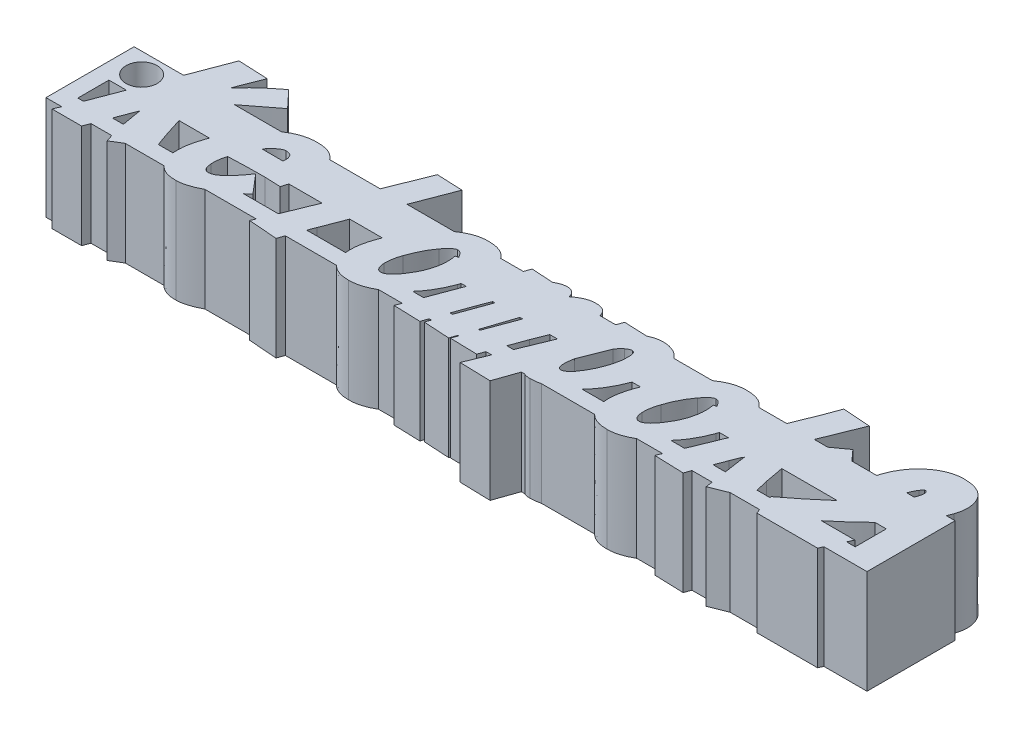
from build123d import *

# Parameters (mm, degrees)
BOSS_EXTRUDE2_DEPTH   = 10
BOSS_EXTRUDE2_2_DEPTH = 10
BOSS_EXTRUDE2_3_DEPTH = 10
BOSS_EXTRUDE2_4_DEPTH = 10
BOSS_EXTRUDE2_5_DEPTH = 10
BOSS_EXTRUDE2_6_DEPTH = 10
BOSS_EXTRUDE2_7_DEPTH = 10
BOSS_EXTRUDE2_8_DEPTH = 10
BOSS_EXTRUDE2_9_DEPTH = 10
SKETCH6_W             = 79.208015904
SKETCH6_H             = 8.5
BOSS_EXTRUDE10_DEPTH  = 10
SKETCH9_R             = 1.5
CUT_EXTRUDE3_DEPTH    = 25


with BuildPart() as part:
    # Sketch4 → Boss-Extrude2 (new body)
    with BuildSketch(Plane(origin=(0, 0, 0), x_dir=(1, 0, 0), z_dir=(0, 1, 0))):
        with BuildLine():
            Line((14.050540425, 0.250084138), (11.135237966, -1.530703367))
            add(Edge.make_bspline(
                [(11.135237966, -1.530703367), (11.087695538, -1.40216121), (10.988992195, -1.135293458), (10.858899008, -0.712824719), (10.733827761, -0.25563048), (10.613807543, 0.236634377), (10.500845834, 0.765237521), (10.396223522, 1.32872214), (10.293179083, 1.926754701), (10.234010137, 2.338125899), (10.203567682, 2.549776612)],
                knots=[0, 0, 0, 0, 0.784209887, 1.628106556, 2.528649659, 3.496628651, 4.527386822, 5.621651958, 6.776338601, 8, 8, 8, 8], degree=3))
            Line((10.203567682, 2.549776612), (8.658646071, -1.530703367))
            Line((8.658646071, -1.530703367), (5.809386063, -1.530703367))
            add(Edge.make_bspline(
                [(5.809386063, -1.530703367), (5.888539112, -1.346164415), (6.053448141, -0.961692313), (6.299001696, -0.359638384), (6.557951226, 0.288309455), (6.728384495, 0.737270317), (6.816533433, 0.969475117)],
                knots=[0, 0, 0, 0, 0.893857492, 1.862280367, 2.894360729, 4, 4, 4, 4], degree=3))
            Line((6.816533433, 0.969475117), (10.81210169, 11.507963294))
            Line((10.81210169, 11.507963294), (13.654285722, 11.38059571))
            Line((13.654285722, 11.38059571), (12.651855669, 8.80494014))
            add(Edge.make_bspline(
                [(12.651855669, 8.80494014), (12.746245393, 8.913323974), (12.939268925, 9.134964948), (13.249556069, 9.461921617), (13.581373248, 9.795587395), (13.9411507, 10.128576132), (14.321060315, 10.469982939), (14.727391349, 10.813868914), (15.157706898, 11.162074621), (15.455811495, 11.391440349), (15.60725533, 11.507963294)],
                knots=[0, 0, 0, 0, 0.859551829, 1.757752034, 2.695460725, 3.673637262, 4.689399904, 5.750344541, 6.857124468, 8, 8, 8, 8], degree=3))
            Line((15.60725533, 11.507963294), (17.142742305, 9.861619348))
            add(Edge.make_bspline(
                [(17.142742305, 9.861619348), (16.954644827, 9.720352478), (16.572785354, 9.433564516), (15.995086376, 8.992239989), (15.403158907, 8.534520747), (14.797056998, 8.061308324), (14.179853892, 7.569521082), (13.546091457, 7.065234295), (12.900668953, 6.541317143), (12.466173219, 6.18542031), (12.24616633, 6.005211969)],
                knots=[0, 0, 0, 0, 0.905720717, 1.838717028, 2.799025323, 3.78667897, 4.799336057, 5.837515503, 6.905026102, 8, 8, 8, 8], degree=3))
            add(Edge.make_bspline(
                [(12.24616633, 6.005211969), (12.323692162, 5.716586261), (12.475291816, 5.152186544), (12.702643856, 4.32655531), (12.93127978, 3.544355947), (13.159090517, 2.804116898), (13.38038451, 2.104692149), (13.606512099, 1.449340233), (13.823732542, 0.833840494), (13.976451144, 0.440774548), (14.050540425, 0.250084138)],
                knots=[0, 0, 0, 0, 1.188561491, 2.324199641, 3.405703956, 4.429397032, 5.404413241, 6.323022466, 7.186437956, 8, 8, 8, 8], degree=3))
        make_face()
    extrude(amount=BOSS_EXTRUDE2_DEPTH)



with BuildPart() as body_2:
    # Sketch4 → Boss-Extrude2 2 (new body)
    with BuildSketch(Plane(origin=(0, 0, 0), x_dir=(1, 0, 0), z_dir=(0, 1, 0))):
        with BuildLine():
            add(Edge.make_bspline(
                [(22.624265698, 1.035517567), (22.499652301, 0.932039331), (22.256199499, 0.729877549), (21.891645526, 0.440820924), (21.535778389, 0.172404589), (21.190082997, -0.077348305), (20.853907058, -0.30770088), (20.526264385, -0.517011922), (20.208627222, -0.708998472), (19.898841945, -0.878661463), (19.600396232, -1.029998384), (19.310865328, -1.160913158), (19.030519563, -1.271513758), (18.759500044, -1.364784331), (18.496877572, -1.435549508), (18.244101779, -1.487556517), (18.000708181, -1.523067304), (17.841018801, -1.528198618), (17.763069608, -1.530703367)],
                knots=[0, 0, 0, 0, 1.391070573, 2.717685548, 3.995225702, 5.21895646, 6.380134823, 7.494610867, 8.557662761, 9.567011913, 10.527286661, 11.430908901, 12.294832988, 13.114784853, 13.891181043, 14.628789799, 15.330671029, 16, 16, 16, 16], degree=3))
            add(Edge.make_bspline(
                [(17.763069608, -1.530703367), (17.622875549, -1.527002352), (17.352587373, -1.519866953), (16.965148021, -1.455031968), (16.615408616, -1.339132781), (16.304933532, -1.174392099), (16.029771467, -0.96498885), (15.800082319, -0.701190982), (15.60230167, -0.394793736), (15.510625531, -0.163799115), (15.463377134, -0.044748231)],
                knots=[0, 0, 0, 0, 1.14053067, 2.198894579, 3.18440771, 4.126236127, 5.047824347, 5.981552319, 6.959724779, 8, 8, 8, 8], degree=3))
            add(Edge.make_bspline(
                [(15.463377134, -0.044748231), (15.429258258, 0.066244253), (15.359513545, 0.29313153), (15.303718194, 0.654680179), (15.279768863, 1.039166001), (15.295207011, 1.447411835), (15.349425724, 1.879926103), (15.437192889, 2.335976324), (15.560024408, 2.817551267), (15.667326149, 3.141630068), (15.722829618, 3.309264793)],
                knots=[0, 0, 0, 0, 0.812872449, 1.66164781, 2.55596979, 3.50977609, 4.519899369, 5.608110557, 6.762758536, 8, 8, 8, 8], degree=3))
            add(Edge.make_bspline(
                [(15.722829618, 3.309264793), (15.790545955, 3.497279931), (15.924016187, 3.867861474), (16.160551761, 4.401032894), (16.41278506, 4.910515257), (16.696168913, 5.388299853), (16.994470205, 5.844746287), (17.321093864, 6.270231547), (17.666642212, 6.672360196), (17.918415293, 6.916680108), (18.043750023, 7.038304588)],
                knots=[0, 0, 0, 0, 1.080935972, 2.130546102, 3.154073367, 4.155083915, 5.134372394, 6.102621782, 7.055469378, 8, 8, 8, 8], degree=3))
            add(Edge.make_bspline(
                [(18.043750023, 7.038304588), (18.173247332, 7.152923474), (18.426681532, 7.377239682), (18.829745706, 7.67006775), (19.238790464, 7.919305759), (19.655456317, 8.125116155), (20.08184476, 8.279457337), (20.513712125, 8.395585334), (20.954620553, 8.462225636), (21.251315043, 8.472122693), (21.400121705, 8.477086546)],
                knots=[0, 0, 0, 0, 1.109112086, 2.170600574, 3.191491309, 4.179676445, 5.146829528, 6.096350185, 7.045227389, 8, 8, 8, 8], degree=3))
            add(Edge.make_bspline(
                [(21.400121705, 8.477086546), (21.550597253, 8.47301465), (21.838437179, 8.465225648), (22.248052871, 8.394097603), (22.613975274, 8.277391483), (22.935578013, 8.111014918), (23.212422016, 7.895646353), (23.441259174, 7.630196978), (23.630100886, 7.320174687), (23.710380532, 7.087377657), (23.751704675, 6.96754482)],
                knots=[0, 0, 0, 0, 1.193090666, 2.282225473, 3.286311646, 4.229385653, 5.140326509, 6.051075119, 6.996786178, 8, 8, 8, 8], degree=3))
            add(Edge.make_bspline(
                [(23.751704675, 6.96754482), (23.781301198, 6.847781062), (23.843179105, 6.59738913), (23.881358717, 6.193230931), (23.883028923, 5.75208076), (23.842109625, 5.27220055), (23.767011645, 4.754465879), (23.648111696, 4.198622529), (23.495698883, 3.60312774), (23.367686268, 3.197037924), (23.301200816, 2.986128517)],
                knots=[0, 0, 0, 0, 0.728497765, 1.523081497, 2.39227737, 3.3341221, 4.367451498, 5.483232794, 6.692875668, 8, 8, 8, 8], degree=3))
            add(Edge.make_bspline(
                [(23.301200816, 2.986128517), (23.041853901, 3.004398577), (22.536909495, 3.039970099), (22.030764535, 3.046591673), (21.784583113, 3.049812308)],
                knots=[0, 0, 0, 0, 1.027229582, 2, 2, 2, 2], degree=3))
            add(Edge.make_bspline(
                [(21.784583113, 3.049812308), (21.499180646, 3.048847572), (20.923624368, 3.046902038), (20.050838442, 3.032707095), (19.161588252, 3.006566101), (18.562633093, 2.981999837), (18.260746646, 2.969617904)],
                knots=[0, 0, 0, 0, 0.971572485, 1.95931958, 2.971452619, 4, 4, 4, 4], degree=3))
            add(Edge.make_bspline(
                [(18.260746646, 2.969617904), (18.223014936, 2.846791928), (18.149533739, 2.607592592), (18.081438463, 2.248849546), (18.05058013, 1.903151397), (18.060240294, 1.6786683), (18.064977953, 1.568574489)],
                knots=[0, 0, 0, 0, 1.082333424, 2.107806866, 3.072006958, 4, 4, 4, 4], degree=3))
            add(Edge.make_bspline(
                [(18.064977953, 1.568574489), (18.071762362, 1.500040354), (18.08447221, 1.371649143), (18.118453876, 1.192273567), (18.169281136, 1.040063801), (18.235974466, 0.915187596), (18.313604218, 0.814654261), (18.409211048, 0.74256848), (18.521064611, 0.701777581), (18.600075777, 0.696309166), (18.640490736, 0.69351202)],
                knots=[0, 0, 0, 0, 1.422743012, 2.66535353, 3.764839852, 4.724340628, 5.579401389, 6.368983025, 7.165719376, 8, 8, 8, 8], degree=3))
            add(Edge.make_bspline(
                [(18.640490736, 0.69351202), (18.687073912, 0.695991771), (18.782128563, 0.701051791), (18.926135097, 0.737113171), (19.075282745, 0.791246966), (19.228943441, 0.869689703), (19.383992003, 0.974021947), (19.548104656, 1.093619063), (19.71559583, 1.238436519), (19.824434859, 1.346935211), (19.881145343, 1.403468363)],
                knots=[0, 0, 0, 0, 0.763034404, 1.556999236, 2.421266155, 3.360662658, 4.375763195, 5.481460041, 6.68771688, 8, 8, 8, 8], degree=3))
            add(Edge.make_bspline(
                [(19.881145343, 1.403468363), (19.989552924, 1.517727374), (20.206016113, 1.745874423), (20.503860448, 2.111366522), (20.786478005, 2.488081063), (20.958093808, 2.750861576), (21.043964204, 2.882347523)],
                knots=[0, 0, 0, 0, 1.002604599, 2.001953979, 3.000249405, 4, 4, 4, 4], degree=3))
            Line((21.043964204, 2.882347523), (22.624265698, 1.035517567))
        make_face()
        with BuildLine():
            add(Edge.make_bspline(
                [(21.289264734, 5.257517083), (21.300844399, 5.320187262), (21.323447112, 5.442515158), (21.320604207, 5.627955106), (21.285484386, 5.808007732), (21.237861077, 5.920196833), (21.213787648, 5.976908062)],
                knots=[0, 0, 0, 0, 1.035215894, 2.020670521, 2.999455327, 4, 4, 4, 4], degree=3))
            add(Edge.make_bspline(
                [(21.213787648, 5.976908062), (21.185253505, 6.022118135), (21.127631409, 6.113415748), (20.981742274, 6.203505619), (20.804210227, 6.258145621), (20.673370694, 6.263915312), (20.602894981, 6.267023113)],
                knots=[0, 0, 0, 0, 0.891253418, 1.799804852, 2.814881707, 4, 4, 4, 4], degree=3))
            add(Edge.make_bspline(
                [(20.602894981, 6.267023113), (20.564127462, 6.264548969), (20.482762621, 6.259356265), (20.358928538, 6.220623305), (20.227745368, 6.161225665), (20.092292548, 6.073930287), (19.94658989, 5.967787448), (19.797730909, 5.8341161), (19.63771324, 5.680845875), (19.534432867, 5.565680003), (19.480173322, 5.505176273)],
                knots=[0, 0, 0, 0, 0.668342593, 1.402710055, 2.222495443, 3.148784853, 4.177361244, 5.331300504, 6.597967686, 8, 8, 8, 8], degree=3))
            add(Edge.make_bspline(
                [(19.480173322, 5.505176273), (19.440389959, 5.456166607), (19.372495159, 5.372526079), (19.301858162, 5.291192689), (19.272611334, 5.257517083)],
                knots=[0, 0, 0, 0, 1.171911923, 2, 2, 2, 2], degree=3))
            Line((19.272611334, 5.257517083), (21.289264734, 5.257517083))
        make_face(mode=Mode.SUBTRACT)
    extrude(amount=BOSS_EXTRUDE2_2_DEPTH)


with BuildPart() as body_3:
    # Sketch4 → Boss-Extrude2 3 (new body)
    with BuildSketch(Plane(origin=(0, 0, 0), x_dir=(1, 0, 0), z_dir=(0, 1, 0))):
        with BuildLine():
            Line((32.365527151, 11.463148774), (28.499685136, 1.349219207))
            add(Edge.make_bspline(
                [(28.499685136, 1.349219207), (28.397424196, 1.088513869), (28.198588365, 0.581599276), (27.923034565, -0.161469756), (27.663110595, -0.858847662), (27.505156532, -1.311865117), (27.428853974, -1.530703367)],
                knots=[0, 0, 0, 0, 1.093622992, 2.126436907, 3.094941564, 4, 4, 4, 4], degree=3))
            Line((27.428853974, -1.530703367), (24.655071052, -1.327858698))
            add(Edge.make_bspline(
                [(24.655071052, -1.327858698), (24.713906682, -1.190214812), (24.834621177, -0.907807496), (25.022144034, -0.476101515), (25.209281933, -0.020800742), (25.408061298, 0.450789028), (25.610730573, 0.944473343), (25.824011649, 1.455717472), (26.036734947, 1.990513753), (26.184002305, 2.351757248), (26.258959136, 2.535624658)],
                knots=[0, 0, 0, 0, 0.858797452, 1.762015657, 2.700225699, 3.682848602, 4.698090038, 5.761909301, 6.860846093, 8, 8, 8, 8], degree=3))
            Line((26.258959136, 2.535624658), (29.893652574, 11.569288426))
            Line((29.893652574, 11.569288426), (32.365527151, 11.463148774))
        make_face()
    extrude(amount=BOSS_EXTRUDE2_3_DEPTH)


with BuildPart() as body_4:
    # Sketch4 → Boss-Extrude2 4 (new body)
    with BuildSketch(Plane(origin=(0, 0, 0), x_dir=(1, 0, 0), z_dir=(0, 1, 0))):
        with BuildLine():
            add(Edge.make_bspline(
                [(40.038244707, 3.370589925), (39.982126243, 3.215663655), (39.870497367, 2.907489765), (39.667054808, 2.461518646), (39.444603074, 2.029746196), (39.195062904, 1.614974524), (38.922486456, 1.216606363), (38.622775797, 0.836269086), (38.303396234, 0.468241319), (38.070373363, 0.239902733), (37.953190197, 0.125075214)],
                knots=[0, 0, 0, 0, 1.01501599, 2.019034128, 3.017989721, 4.006742464, 4.999841863, 5.990337927, 6.989375757, 8, 8, 8, 8], degree=3))
            add(Edge.make_bspline(
                [(37.953190197, 0.125075214), (37.808089027, -0.006918661), (37.526834487, -0.262766882), (37.08434304, -0.599165239), (36.64487223, -0.886294613), (36.202511102, -1.119592381), (35.760783248, -1.303263461), (35.317298468, -1.433588666), (34.873455506, -1.51550291), (34.576714743, -1.52565958), (34.42935373, -1.530703367)],
                knots=[0, 0, 0, 0, 1.180019893, 2.287272735, 3.341173446, 4.335951553, 5.292850594, 6.21515141, 7.1136469, 8, 8, 8, 8], degree=3))
            add(Edge.make_bspline(
                [(34.42935373, -1.530703367), (34.283632448, -1.526458156), (34.003683133, -1.518302559), (33.604187855, -1.448770425), (33.247702342, -1.326899701), (32.930070645, -1.162200694), (32.657740597, -0.94359491), (32.427473919, -0.678434768), (32.237537364, -0.366315825), (32.153880802, -0.132274302), (32.110791985, -0.011727005)],
                knots=[0, 0, 0, 0, 1.166914392, 2.241792542, 3.233713519, 4.174778755, 5.093510918, 6.013084697, 6.976603536, 8, 8, 8, 8], degree=3))
            add(Edge.make_bspline(
                [(32.110791985, -0.011727005), (32.078451484, 0.096972006), (32.012682975, 0.318025226), (31.958832273, 0.667357059), (31.934475738, 1.034421857), (31.948326433, 1.420348375), (31.993402089, 1.824017588), (32.073361825, 2.24599362), (32.18300941, 2.687794243), (32.281696802, 2.984383796), (32.332505926, 3.137082689)],
                knots=[0, 0, 0, 0, 0.84642706, 1.721316727, 2.633657811, 3.591547291, 4.602158471, 5.665521778, 6.798095765, 8, 8, 8, 8], degree=3))
            add(Edge.make_bspline(
                [(32.332505926, 3.137082689), (32.397928126, 3.321133602), (32.526714985, 3.683446984), (32.754524359, 4.203651427), (32.990187786, 4.702069236), (33.251574131, 5.17040153), (33.525360387, 5.6164975), (33.825305408, 6.029759486), (34.133987986, 6.423591766), (34.361360495, 6.662620121), (34.47416825, 6.781210763)],
                knots=[0, 0, 0, 0, 1.099825324, 2.1650609, 3.196961452, 4.203854639, 5.18442365, 6.142936629, 7.078643458, 8, 8, 8, 8], degree=3))
            add(Edge.make_bspline(
                [(34.47416825, 6.781210763), (34.611291047, 6.916292194), (34.877408121, 7.178447546), (35.299279831, 7.524500711), (35.724857487, 7.816328052), (36.152710069, 8.055661216), (36.582127298, 8.246043679), (37.017031888, 8.377759708), (37.454571853, 8.46245127), (37.748400052, 8.47223232), (37.894223724, 8.477086546)],
                knots=[0, 0, 0, 0, 1.177608953, 2.285410271, 3.334477404, 4.33187011, 5.282184666, 6.203085272, 7.108211176, 8, 8, 8, 8], degree=3))
            add(Edge.make_bspline(
                [(37.894223724, 8.477086546), (37.996535669, 8.475711792), (38.194579151, 8.473050703), (38.480432938, 8.440298019), (38.746169665, 8.395461766), (38.99063593, 8.327129769), (39.213573487, 8.237313144), (39.415413024, 8.128371983), (39.597545954, 8.001458137), (39.701445156, 7.899917994), (39.752846974, 7.849683266)],
                knots=[0, 0, 0, 0, 1.21682243, 2.355382367, 3.419801373, 4.420909787, 5.369491889, 6.273713858, 7.145958333, 8, 8, 8, 8], degree=3))
            add(Edge.make_bspline(
                [(39.752846974, 7.849683266), (39.803573866, 7.793249739), (39.906710103, 7.67851096), (40.041536536, 7.485161977), (40.171310669, 7.277197358), (40.284559976, 7.047600417), (40.392015141, 6.801928028), (40.485745627, 6.53690764), (40.5682328, 6.253170737), (40.613909567, 6.056554366), (40.637344079, 5.955680132)],
                knots=[0, 0, 0, 0, 0.860065863, 1.74865745, 2.669563957, 3.638872161, 4.649604968, 5.710379448, 6.825307782, 8, 8, 8, 8], degree=3))
            Line((40.637344079, 5.955680132), (40.342511711, 5.825953889))
            add(Edge.make_bspline(
                [(40.342511711, 5.825953889), (40.349195965, 5.601796347), (40.36218468, 5.16621765), (40.309540513, 4.530855747), (40.211187776, 3.932053029), (40.095082579, 3.555115204), (40.038244707, 3.370589925)],
                knots=[0, 0, 0, 0, 1.080653131, 2.099904727, 3.069831712, 4, 4, 4, 4], degree=3))
        make_face()
        with BuildLine():
            add(Edge.make_bspline(
                [(37.380036073, 3.365872607), (37.43515134, 3.552677203), (37.54404211, 3.921745477), (37.622316208, 4.488916539), (37.631314455, 5.054186162), (37.575468783, 5.423834599), (37.547500858, 5.608957266)],
                knots=[0, 0, 0, 0, 1.027056828, 2.029147561, 3.012982546, 4, 4, 4, 4], degree=3))
            Line((37.547500858, 5.608957266), (37.844691886, 5.698586306))
            add(Edge.make_bspline(
                [(37.844691886, 5.698586306), (37.811355245, 5.730988916), (37.739855434, 5.800485436), (37.694408512, 5.889369049), (37.670151124, 5.93681086)],
                knots=[0, 0, 0, 0, 0.932495901, 2, 2, 2, 2], degree=3))
            add(Edge.make_bspline(
                [(37.670151124, 5.93681086), (37.636222369, 5.986680808), (37.57170279, 6.081514469), (37.443507205, 6.188509149), (37.29858764, 6.254839736), (37.195943881, 6.262938222), (37.144170178, 6.267023113)],
                knots=[0, 0, 0, 0, 1.109746528, 2.110315559, 3.046839665, 4, 4, 4, 4], degree=3))
            add(Edge.make_bspline(
                [(37.144170178, 6.267023113), (37.113143748, 6.264693739), (37.045630926, 6.259625073), (36.944419892, 6.214460539), (36.835325213, 6.149523877), (36.716055858, 6.061728861), (36.59308131, 5.94384326), (36.457717278, 5.805185388), (36.31663337, 5.638576822), (36.222256313, 5.517331994), (36.172402692, 5.453285776)],
                knots=[0, 0, 0, 0, 0.571144536, 1.242797803, 2.017584967, 2.92111095, 3.969590932, 5.161241196, 6.500457551, 8, 8, 8, 8], degree=3))
            add(Edge.make_bspline(
                [(36.172402692, 5.453285776), (36.057625133, 5.293348746), (35.820624526, 4.963099753), (35.514919637, 4.4101837), (35.230389688, 3.798736922), (35.070806787, 3.362480882), (34.988355901, 3.137082689)],
                knots=[0, 0, 0, 0, 0.903892015, 1.866418475, 2.897653271, 4, 4, 4, 4], degree=3))
            add(Edge.make_bspline(
                [(34.988355901, 3.137082689), (34.94268644, 2.995446342), (34.855251, 2.724279657), (34.767484146, 2.321840696), (34.718202285, 1.944854051), (34.722248744, 1.701565997), (34.724186098, 1.585085102)],
                knots=[0, 0, 0, 0, 1.127193354, 2.158042699, 3.118111926, 4, 4, 4, 4], degree=3))
            add(Edge.make_bspline(
                [(34.724186098, 1.585085102), (34.729950131, 1.514963552), (34.740705754, 1.384117488), (34.775221263, 1.201661111), (34.826746822, 1.047907186), (34.890249423, 0.91966545), (34.967339899, 0.816936676), (35.063743403, 0.746212619), (35.173235305, 0.700672743), (35.25206749, 0.695944485), (35.292622905, 0.69351202)],
                knots=[0, 0, 0, 0, 1.440320938, 2.687623499, 3.79252699, 4.750247779, 5.610272404, 6.392800514, 7.173172209, 8, 8, 8, 8], degree=3))
            add(Edge.make_bspline(
                [(35.292622905, 0.69351202), (35.340914958, 0.697071557), (35.440445071, 0.704407777), (35.590664777, 0.75502544), (35.741419066, 0.840432249), (35.897425977, 0.955200663), (36.059204537, 1.100727137), (36.222294397, 1.280671844), (36.390754384, 1.49192362), (36.498074944, 1.647276699), (36.554505442, 1.728963298)],
                knots=[0, 0, 0, 0, 0.686159252, 1.414176948, 2.229351996, 3.141344698, 4.162207593, 5.316879318, 6.589181455, 8, 8, 8, 8], degree=3))
            add(Edge.make_bspline(
                [(36.554505442, 1.728963298), (36.646983665, 1.868436002), (36.826811999, 2.139647356), (37.054302003, 2.554864821), (37.243229833, 2.959715957), (37.33523402, 3.232862212), (37.380036073, 3.365872607)],
                knots=[0, 0, 0, 0, 1.090982365, 2.12146746, 3.085236023, 4, 4, 4, 4], degree=3))
        make_face(mode=Mode.SUBTRACT)
    extrude(amount=BOSS_EXTRUDE2_4_DEPTH)


with BuildPart() as body_5:
    # Sketch4 → Boss-Extrude2 5 (new body)
    with BuildSketch(Plane(origin=(0, 0, 0), x_dir=(1, 0, 0), z_dir=(0, 1, 0))):
        with BuildLine():
            add(Edge.make_bspline(
                [(49.045963227, 4.656059052), (49.028008386, 4.602552347), (48.987507875, 4.481857936), (48.916263471, 4.28045212), (48.826772347, 4.039306922), (48.720115837, 3.756942901), (48.594734992, 3.433943297), (48.451955819, 3.06947721), (48.287486011, 2.665576187), (48.173907823, 2.382367036), (48.114292943, 2.233716313)],
                knots=[0, 0, 0, 0, 0.521829356, 1.17708402, 1.975163261, 2.900006666, 3.967841368, 5.178714456, 6.519164605, 8, 8, 8, 8], degree=3))
            add(Edge.make_bspline(
                [(48.114292943, 2.233716313), (48.105567882, 2.211731571), (48.085369179, 2.16083642), (48.052696354, 2.072346486), (48.009425878, 1.963163765), (47.963497443, 1.829255444), (47.905618494, 1.674329025), (47.843654646, 1.494954986), (47.768393104, 1.295010945), (47.692388562, 1.069730031), (47.604286549, 0.823427194), (47.510582697, 0.553250435), (47.405768161, 0.262477765), (47.298406171, -0.052957368), (47.179495811, -0.389631087), (47.055173811, -0.749959375), (46.923033839, -1.133101835), (46.831281456, -1.395507937), (46.784009296, -1.530703367)],
                knots=[0, 0, 0, 0, 0.284342038, 0.658257955, 1.133959297, 1.696006654, 2.359793001, 3.122118475, 3.977288858, 4.92784606, 5.980104766, 7.122019585, 8.365647333, 9.695808317, 11.127662079, 12.658102971, 14.278206162, 16, 16, 16, 16], degree=3))
            Line((46.784009296, -1.530703367), (44.168256524, -1.462302258))
            add(Edge.make_bspline(
                [(44.168256524, -1.462302258), (44.241995473, -1.263326868), (44.395964337, -0.847861021), (44.639588758, -0.200857371), (44.89874065, 0.498497949), (45.176598076, 1.247937132), (45.474563271, 2.046944202), (45.787311271, 2.897783754), (46.1231758, 3.7970759), (46.351017633, 4.414609788), (46.467948997, 4.731536138)],
                knots=[0, 0, 0, 0, 0.770817391, 1.609486981, 2.511336452, 3.480040618, 4.512922173, 5.608988378, 6.772902019, 8, 8, 8, 8], degree=3))
            add(Edge.make_bspline(
                [(46.467948997, 4.731536138), (46.535586518, 4.933675139), (46.669939511, 5.335197544), (46.776105249, 5.745072925), (46.828823816, 5.948604155)],
                knots=[0, 0, 0, 0, 1.006862872, 2, 2, 2, 2], degree=3))
            add(Edge.make_bspline(
                [(46.828823816, 5.948604155), (46.839519195, 5.992859459), (46.858079979, 6.06966021), (46.884926739, 6.163536712), (46.899566644, 6.226161008), (46.919643393, 6.246816161), (46.925528833, 6.252871159)],
                knots=[0, 0, 0, 0, 1.692328866, 2.936871158, 3.688346874, 4, 4, 4, 4], degree=3))
            add(Edge.make_bspline(
                [(46.925528833, 6.252871159), (46.90080528, 6.249317976), (46.842449045, 6.240931222), (46.751653966, 6.192771757), (46.641224528, 6.124059419), (46.566300152, 6.062882594), (46.524556812, 6.028798559)],
                knots=[0, 0, 0, 0, 0.640091037, 1.51083877, 2.613189589, 4, 4, 4, 4], degree=3))
            add(Edge.make_bspline(
                [(46.524556812, 6.028798559), (46.519993198, 6.007534286), (46.509306854, 5.957740998), (46.486885553, 5.874271675), (46.464532423, 5.770011893), (46.446861512, 5.694622142), (46.437286431, 5.653771786)],
                knots=[0, 0, 0, 0, 0.677678063, 1.586878594, 2.69243676, 4, 4, 4, 4], degree=3))
            add(Edge.make_bspline(
                [(46.437286431, 5.653771786), (46.432022347, 5.630906698), (46.417547172, 5.568032294), (46.379370785, 5.450271026), (46.328968459, 5.279784427), (46.257173351, 5.059403347), (46.170378886, 4.788015651), (46.065864103, 4.466684821), (45.946289479, 4.093529697), (45.806596698, 3.670185557), (45.651283228, 3.194932276), (45.476441483, 2.67009592), (45.285150154, 2.09387682), (45.077921157, 1.467149431), (44.853966465, 0.789127611), (44.610688323, 0.061461318), (44.351518907, -0.718039467), (44.171543574, -1.254001552), (44.078627484, -1.530703367)],
                knots=[0, 0, 0, 0, 0.148880206, 0.409390693, 0.785104261, 1.277520356, 1.880397929, 2.593739277, 3.422293539, 4.367603484, 5.42338108, 6.595930523, 7.878948767, 9.277172875, 10.785865614, 12.411336452, 14.147276182, 16, 16, 16, 16], degree=3))
            Line((44.078627484, -1.530703367), (41.571373023, -1.379749195))
            add(Edge.make_bspline(
                [(41.571373023, -1.379749195), (41.649985372, -1.158031947), (41.803056631, -0.726311763), (42.026345497, -0.097055203), (42.239911501, 0.495013868), (42.436806529, 1.051592263), (42.62374853, 1.571067809), (42.798331945, 2.054576919), (42.960220878, 2.50225194), (43.112482996, 2.912678216), (43.248008698, 3.287675805), (43.373684301, 3.625507904), (43.486565712, 3.927545104), (43.588074062, 4.192957538), (43.67528736, 4.42285791), (43.750179624, 4.615722372), (43.81378499, 4.772248368), (43.853622458, 4.863683085), (43.871065496, 4.903718241)],
                knots=[0, 0, 0, 0, 1.687419252, 3.285684619, 4.789488201, 6.202243831, 7.520538755, 8.749688051, 9.889695676, 10.935271811, 11.889775638, 12.749856816, 13.520821835, 14.202685014, 14.788178881, 15.284597505, 15.686757382, 16, 16, 16, 16], degree=3))
            add(Edge.make_bspline(
                [(43.871065496, 4.903718241), (43.899097994, 5.008949199), (43.951284053, 5.204850006), (44.016579672, 5.47975118), (44.070949913, 5.711751617), (44.112691687, 5.900870683), (44.137629057, 6.050014142), (44.14605449, 6.151978681), (44.157996548, 6.223271909), (44.136806442, 6.24609738), (44.130517981, 6.252871159)],
                knots=[0, 0, 0, 0, 1.885119383, 3.509389413, 4.892807334, 6.006034598, 6.874289175, 7.477045856, 7.844806005, 8, 8, 8, 8], degree=3))
            add(Edge.make_bspline(
                [(44.130517981, 6.252871159), (44.127622535, 6.256142756), (44.111778262, 6.274045378), (44.144155055, 6.280564551), (44.170615183, 6.285892384)],
                knots=[0, 0, 0, 0, 0.365487995, 2, 2, 2, 2], degree=3))
            Line((44.170615183, 6.285892384), (42.722398589, 2.504962092))
            add(Edge.make_bspline(
                [(42.722398589, 2.504962092), (42.706528683, 2.463346224), (42.672492226, 2.374091964), (42.621702118, 2.231377581), (42.564594302, 2.071674702), (42.500715448, 1.895911271), (42.433132231, 1.701929189), (42.356721338, 1.49262204), (42.277509942, 1.265559774), (42.188920878, 1.022580957), (42.0981577, 0.761906092), (42.000906909, 0.484287236), (41.897111877, 0.190521576), (41.78864519, -0.120834689), (41.675528087, -0.4497808), (41.5554572, -0.794735441), (41.430164621, -1.15735701), (41.344209319, -1.404140662), (41.300127244, -1.530703367)],
                knots=[0, 0, 0, 0, 0.499602589, 1.071506177, 1.699173539, 2.402186653, 3.169273061, 4.003395864, 4.901591779, 5.866824366, 6.904446539, 7.997840712, 9.166571387, 10.399398285, 11.696332296, 13.068594861, 14.496632324, 16, 16, 16, 16], degree=3))
            Line((41.300127244, -1.530703367), (38.719754355, -1.445791645))
            Line((38.719754355, -1.445791645), (42.349730475, 8.257731264))
            Line((42.349730475, 8.257731264), (44.446578279, 8.13272234))
            add(Edge.make_bspline(
                [(44.446578279, 8.13272234), (44.523472194, 8.177782201), (44.676148886, 8.267250795), (44.922324029, 8.369391977), (45.180059455, 8.440782487), (45.357429786, 8.464936648), (45.446649673, 8.477086546)],
                knots=[0, 0, 0, 0, 1.001464924, 1.988458414, 2.988164974, 4, 4, 4, 4], degree=3))
            add(Edge.make_bspline(
                [(45.446649673, 8.477086546), (45.513662817, 8.475130319), (45.64087214, 8.471416864), (45.821487157, 8.435265798), (45.98048064, 8.377180707), (46.119803469, 8.295116191), (46.237078836, 8.187936639), (46.329187038, 8.054896351), (46.402458966, 7.900508626), (46.429950357, 7.786697303), (46.444362408, 7.727033001)],
                knots=[0, 0, 0, 0, 1.170336645, 2.221619867, 3.204548898, 4.116800757, 5.031224523, 5.957961552, 6.929484393, 8, 8, 8, 8], degree=3))
            add(Edge.make_bspline(
                [(46.444362408, 7.727033001), (46.519757761, 7.787165899), (46.666099286, 7.903883172), (46.895413602, 8.055926791), (47.123096908, 8.185299182), (47.350048861, 8.293668771), (47.57839241, 8.373248461), (47.805232434, 8.433271926), (48.032894123, 8.470150419), (48.184922503, 8.474782769), (48.260529797, 8.477086546)],
                knots=[0, 0, 0, 0, 1.154194039, 2.240277521, 3.289933504, 4.287964496, 5.2466426, 6.180458297, 7.09509906, 8, 8, 8, 8], degree=3))
            add(Edge.make_bspline(
                [(48.260529797, 8.477086546), (48.359842965, 8.473700031), (48.546785276, 8.467325419), (48.808563031, 8.414433957), (49.032024374, 8.321338823), (49.218221659, 8.191105518), (49.362065055, 8.018855714), (49.464541247, 7.810486405), (49.525062244, 7.565212697), (49.534137459, 7.390097671), (49.538922947, 7.297757073)],
                knots=[0, 0, 0, 0, 1.198718382, 2.256409598, 3.205149227, 4.103573655, 4.972776076, 5.885682923, 6.885091074, 8, 8, 8, 8], degree=3))
            add(Edge.make_bspline(
                [(49.538922947, 7.297757073), (49.5409401, 7.213615625), (49.545147955, 7.038093466), (49.526543567, 6.763120062), (49.490355343, 6.466599829), (49.438277265, 6.146995508), (49.367300151, 5.805510019), (49.276008016, 5.441919899), (49.171183543, 5.055132901), (49.088556653, 4.79180318), (49.045963227, 4.656059052)],
                knots=[0, 0, 0, 0, 0.747908885, 1.560165474, 2.447060816, 3.403090191, 4.438031567, 5.546698941, 6.735345129, 8, 8, 8, 8], degree=3))
        make_face()
    extrude(amount=BOSS_EXTRUDE2_5_DEPTH)


with BuildPart() as body_6:
    # Sketch4 → Boss-Extrude2 6 (new body)
    with BuildSketch(Plane(origin=(0, 0, 0), x_dir=(1, 0, 0), z_dir=(0, 1, 0))):
        with BuildLine():
            add(Edge.make_bspline(
                [(56.654996991, 3.76212731), (56.591983982, 3.587481652), (56.467314114, 3.241949015), (56.243565633, 2.745492868), (56.00093445, 2.271475489), (55.733904806, 1.822410111), (55.443900332, 1.397861429), (55.131301158, 0.996872271), (54.795129349, 0.621200195), (54.551908297, 0.390780744), (54.430781604, 0.276029386)],
                knots=[0, 0, 0, 0, 1.066064431, 2.109185299, 3.125089626, 4.123377184, 5.107882964, 6.076265676, 7.041959675, 8, 8, 8, 8], degree=3))
            add(Edge.make_bspline(
                [(54.430781604, 0.276029386), (54.3127075, 0.175947079), (54.081434233, -0.020085425), (53.716732454, -0.278080081), (53.345606067, -0.497131747), (52.966193209, -0.673289341), (52.583120418, -0.817678303), (52.191802395, -0.918946196), (51.794240685, -0.981965491), (51.526709824, -0.992416452), (51.392828879, -0.997646445)],
                knots=[0, 0, 0, 0, 1.102732484, 2.159936309, 3.179586701, 4.169741849, 5.137753406, 6.093195606, 7.045774484, 8, 8, 8, 8], degree=3))
            add(Edge.make_bspline(
                [(51.392828879, -0.997646445), (51.336144397, -0.998309389), (51.22868649, -0.999566146), (51.076386067, -0.979045826), (50.941246956, -0.950237461), (50.822478589, -0.905610866), (50.723270109, -0.843744864), (50.639321108, -0.769595874), (50.577558798, -0.677860496), (50.550370915, -0.609820225), (50.536635682, -0.575446494)],
                knots=[0, 0, 0, 0, 1.321274629, 2.504766777, 3.577532145, 4.54187297, 5.448259888, 6.292525586, 7.137389277, 8, 8, 8, 8], degree=3))
            add(Edge.make_bspline(
                [(50.536635682, -0.575446494), (50.519332583, -0.623403533), (50.479072471, -0.734987932), (50.409873469, -0.927331026), (50.326075625, -1.169094244), (50.224067679, -1.460851499), (50.103731451, -1.801779669), (49.96712008, -2.193384685), (49.813773476, -2.634442559), (49.706340356, -2.945096085), (49.649779917, -3.108646203)],
                knots=[0, 0, 0, 0, 0.455890168, 1.060745852, 1.827828088, 2.743880854, 3.824499174, 5.060722598, 6.452555248, 8, 8, 8, 8], degree=3))
            Line((49.649779917, -3.108646203), (46.677869644, -3.02609314))
            Line((46.677869644, -3.02609314), (50.397474804, 6.050026489))
            add(Edge.make_bspline(
                [(50.397474804, 6.050026489), (50.447038074, 6.171877294), (50.542588443, 6.406786919), (50.680318556, 6.746855159), (50.803806933, 7.06304405), (50.921051081, 7.351889114), (51.021358178, 7.617890672), (51.114551563, 7.856648684), (51.191829162, 8.07287434), (51.240295933, 8.208202633), (51.263102637, 8.271883218)],
                knots=[0, 0, 0, 0, 1.323866011, 2.552210196, 3.692400966, 4.740017903, 5.689282351, 6.553336076, 7.31925244, 8, 8, 8, 8], degree=3))
            Line((51.263102637, 8.271883218), (53.451938141, 8.179895519))
            add(Edge.make_bspline(
                [(53.451938141, 8.179895519), (53.561868407, 8.228006852), (53.775599254, 8.321546839), (54.103700422, 8.416754378), (54.423578139, 8.480503416), (54.63569554, 8.487705143), (54.739765926, 8.4912385)],
                knots=[0, 0, 0, 0, 1.077549365, 2.095014813, 3.06536407, 4, 4, 4, 4], degree=3))
            add(Edge.make_bspline(
                [(54.739765926, 8.4912385), (54.86827823, 8.487930507), (55.117060126, 8.481526694), (55.47398352, 8.410410742), (55.802160553, 8.300268393), (56.100816676, 8.142569479), (56.369683479, 7.940063515), (56.608732585, 7.692492573), (56.817930796, 7.400736006), (56.926888264, 7.181546458), (56.982850585, 7.068967155)],
                knots=[0, 0, 0, 0, 1.090029021, 2.110144138, 3.077244386, 4.021083702, 4.965230007, 5.923786943, 6.933623338, 8, 8, 8, 8], degree=3))
            add(Edge.make_bspline(
                [(56.982850585, 7.068967155), (57.007827257, 6.951403581), (57.058603834, 6.712401528), (57.094961219, 6.340192592), (57.097720671, 5.951433459), (57.074972121, 5.545340515), (57.017426215, 5.122047909), (56.925344572, 4.683425299), (56.80891295, 4.225842748), (56.707257929, 3.919578193), (56.654996991, 3.76212731)],
                knots=[0, 0, 0, 0, 0.856105707, 1.740428738, 2.659488607, 3.624936579, 4.636957918, 5.700758084, 6.817957671, 8, 8, 8, 8], degree=3))
        make_face()
        with BuildLine():
            add(Edge.make_bspline(
                [(53.999147016, 3.76212731), (54.05046483, 3.920223995), (54.150095324, 4.227159343), (54.252937168, 4.686477786), (54.318700675, 5.12664501), (54.32586927, 5.414545185), (54.329359269, 5.55470811)],
                knots=[0, 0, 0, 0, 1.088876015, 2.113988274, 3.081803543, 4, 4, 4, 4], degree=3))
            add(Edge.make_bspline(
                [(54.329359269, 5.55470811), (54.328392692, 5.611314637), (54.326576861, 5.717656811), (54.31504102, 5.866725026), (54.285685601, 5.99294791), (54.250067547, 6.098435664), (54.200422539, 6.181802822), (54.137168432, 6.241902162), (54.059676069, 6.276947873), (54.004211443, 6.281290488), (53.975560427, 6.283533725)],
                knots=[0, 0, 0, 0, 1.507726492, 2.832445727, 3.969953324, 4.949991192, 5.78650871, 6.527178697, 7.239193891, 8, 8, 8, 8], degree=3))
            add(Edge.make_bspline(
                [(53.975560427, 6.283533725), (53.939826715, 6.280410108), (53.8605163, 6.273477287), (53.736439793, 6.222418894), (53.595900192, 6.147431528), (53.50078956, 6.081050482), (53.449579482, 6.045309172)],
                knots=[0, 0, 0, 0, 0.73198523, 1.624629788, 2.721037888, 4, 4, 4, 4], degree=3))
            add(Edge.make_bspline(
                [(53.449579482, 6.045309172), (53.403000766, 6.007034099), (53.308662846, 5.929513914), (53.182263757, 5.790881941), (53.054953532, 5.642125208), (52.982105582, 5.52969165), (52.944826467, 5.472155047)],
                knots=[0, 0, 0, 0, 0.941664639, 1.90719475, 2.929030571, 4, 4, 4, 4], degree=3))
            Line((52.944826467, 5.472155047), (51.881071282, 2.804511778))
            add(Edge.make_bspline(
                [(51.881071282, 2.804511778), (51.859938304, 2.680497202), (51.82048064, 2.448947932), (51.787148524, 2.124416348), (51.776423397, 1.848871217), (51.795723218, 1.622577639), (51.839055875, 1.442495831), (51.913487093, 1.308529748), (52.02512254, 1.224383087), (52.110935857, 1.214894667), (52.154675719, 1.210058329)],
                knots=[0, 0, 0, 0, 1.690917542, 3.15713473, 4.383723407, 5.392417774, 6.202700659, 6.857133646, 7.417470171, 8, 8, 8, 8], degree=3))
            add(Edge.make_bspline(
                [(52.154675719, 1.210058329), (52.183175797, 1.212104642), (52.242047797, 1.216331667), (52.331449362, 1.245343704), (52.426198026, 1.28765451), (52.525291947, 1.349631567), (52.625520178, 1.431489015), (52.733206138, 1.526806837), (52.846287266, 1.639149833), (52.918734247, 1.724452314), (52.956619762, 1.7690605)],
                knots=[0, 0, 0, 0, 0.681174583, 1.407087713, 2.231973937, 3.160911298, 4.191804689, 5.324063015, 6.600642181, 8, 8, 8, 8], degree=3))
            add(Edge.make_bspline(
                [(52.956619762, 1.7690605), (53.062895944, 1.919176311), (53.276681332, 2.221149589), (53.554236374, 2.707747186), (53.798330972, 3.222138391), (53.931789884, 3.5810058), (53.999147016, 3.76212731)],
                knots=[0, 0, 0, 0, 0.977159009, 1.965655091, 2.973259724, 4, 4, 4, 4], degree=3))
        make_face(mode=Mode.SUBTRACT)
    extrude(amount=BOSS_EXTRUDE2_6_DEPTH)


with BuildPart() as body_7:
    # Sketch4 → Boss-Extrude2 7 (new body)
    with BuildSketch(Plane(origin=(0, 0, 0), x_dir=(1, 0, 0), z_dir=(0, 1, 0))):
        with BuildLine():
            add(Edge.make_bspline(
                [(64.945683191, 3.370589925), (64.889564727, 3.215663655), (64.777935851, 2.907489765), (64.574493293, 2.461518646), (64.352041558, 2.029746196), (64.102501388, 1.614974524), (63.82992494, 1.216606363), (63.530214281, 0.836269086), (63.210834719, 0.468241319), (62.977811847, 0.239902733), (62.860628682, 0.125075214)],
                knots=[0, 0, 0, 0, 1.01501599, 2.019034128, 3.017989721, 4.006742464, 4.999841863, 5.990337927, 6.989375757, 8, 8, 8, 8], degree=3))
            add(Edge.make_bspline(
                [(62.860628682, 0.125075214), (62.715527511, -0.006918661), (62.434272971, -0.262766882), (61.991781524, -0.599165239), (61.552310714, -0.886294613), (61.109949586, -1.119592381), (60.668221732, -1.303263461), (60.224736952, -1.433588666), (59.78089399, -1.51550291), (59.484153227, -1.52565958), (59.336792214, -1.530703367)],
                knots=[0, 0, 0, 0, 1.180019893, 2.287272735, 3.341173446, 4.335951553, 5.292850594, 6.21515141, 7.1136469, 8, 8, 8, 8], degree=3))
            add(Edge.make_bspline(
                [(59.336792214, -1.530703367), (59.191070932, -1.526458156), (58.911121617, -1.518302559), (58.511626339, -1.448770425), (58.155140826, -1.326899701), (57.837509129, -1.162200694), (57.565179081, -0.94359491), (57.334912403, -0.678434768), (57.144975848, -0.366315825), (57.061319286, -0.132274302), (57.018230469, -0.011727005)],
                knots=[0, 0, 0, 0, 1.166914392, 2.241792542, 3.233713519, 4.174778755, 5.093510918, 6.013084697, 6.976603536, 8, 8, 8, 8], degree=3))
            add(Edge.make_bspline(
                [(57.018230469, -0.011727005), (56.985889968, 0.096972006), (56.92012146, 0.318025226), (56.866270757, 0.667357059), (56.841914222, 1.034421857), (56.855764917, 1.420348375), (56.900840573, 1.824017588), (56.980800309, 2.24599362), (57.090447894, 2.687794243), (57.189135286, 2.984383796), (57.23994441, 3.137082689)],
                knots=[0, 0, 0, 0, 0.84642706, 1.721316727, 2.633657811, 3.591547291, 4.602158471, 5.665521778, 6.798095765, 8, 8, 8, 8], degree=3))
            add(Edge.make_bspline(
                [(57.23994441, 3.137082689), (57.305366611, 3.321133602), (57.434153469, 3.683446984), (57.661962843, 4.203651427), (57.89762627, 4.702069236), (58.159012615, 5.17040153), (58.432798871, 5.6164975), (58.732743893, 6.029759486), (59.04142647, 6.423591766), (59.26879898, 6.662620121), (59.381606734, 6.781210763)],
                knots=[0, 0, 0, 0, 1.099825324, 2.1650609, 3.196961452, 4.203854639, 5.18442365, 6.142936629, 7.078643458, 8, 8, 8, 8], degree=3))
            add(Edge.make_bspline(
                [(59.381606734, 6.781210763), (59.518729531, 6.916292194), (59.784846605, 7.178447546), (60.206718316, 7.524500711), (60.632295971, 7.816328052), (61.060148553, 8.055661216), (61.489565783, 8.246043679), (61.924470372, 8.377759708), (62.362010337, 8.46245127), (62.655838536, 8.47223232), (62.801662208, 8.477086546)],
                knots=[0, 0, 0, 0, 1.177608953, 2.285410271, 3.334477404, 4.33187011, 5.282184666, 6.203085272, 7.108211176, 8, 8, 8, 8], degree=3))
            add(Edge.make_bspline(
                [(62.801662208, 8.477086546), (62.903974153, 8.475711792), (63.102017635, 8.473050703), (63.387871422, 8.440298019), (63.65360815, 8.395461766), (63.898074414, 8.327129769), (64.121011971, 8.237313144), (64.322851508, 8.128371983), (64.504984439, 8.001458137), (64.60888364, 7.899917994), (64.660285458, 7.849683266)],
                knots=[0, 0, 0, 0, 1.21682243, 2.355382367, 3.419801373, 4.420909787, 5.369491889, 6.273713858, 7.145958333, 8, 8, 8, 8], degree=3))
            add(Edge.make_bspline(
                [(64.660285458, 7.849683266), (64.71101235, 7.793249739), (64.814148588, 7.67851096), (64.94897502, 7.485161977), (65.078749153, 7.277197358), (65.19199846, 7.047600417), (65.299453625, 6.801928028), (65.393184111, 6.53690764), (65.475671284, 6.253170737), (65.521348051, 6.056554366), (65.544782564, 5.955680132)],
                knots=[0, 0, 0, 0, 0.860065863, 1.74865745, 2.669563957, 3.638872161, 4.649604968, 5.710379448, 6.825307782, 8, 8, 8, 8], degree=3))
            Line((65.544782564, 5.955680132), (65.249950195, 5.825953889))
            add(Edge.make_bspline(
                [(65.249950195, 5.825953889), (65.256634449, 5.601796347), (65.269623164, 5.16621765), (65.216978997, 4.530855747), (65.11862626, 3.932053029), (65.002521063, 3.555115204), (64.945683191, 3.370589925)],
                knots=[0, 0, 0, 0, 1.080653131, 2.099904727, 3.069831712, 4, 4, 4, 4], degree=3))
        make_face()
        with BuildLine():
            add(Edge.make_bspline(
                [(62.287474557, 3.365872607), (62.342589824, 3.552677203), (62.451480594, 3.921745477), (62.529754693, 4.488916539), (62.538752939, 5.054186162), (62.482907267, 5.423834599), (62.454939343, 5.608957266)],
                knots=[0, 0, 0, 0, 1.027056828, 2.029147561, 3.012982546, 4, 4, 4, 4], degree=3))
            Line((62.454939343, 5.608957266), (62.75213037, 5.698586306))
            add(Edge.make_bspline(
                [(62.75213037, 5.698586306), (62.71879373, 5.730988916), (62.647293919, 5.800485436), (62.601846996, 5.889369049), (62.577589608, 5.93681086)],
                knots=[0, 0, 0, 0, 0.932495901, 2, 2, 2, 2], degree=3))
            add(Edge.make_bspline(
                [(62.577589608, 5.93681086), (62.543660853, 5.986680808), (62.479141274, 6.081514469), (62.350945689, 6.188509149), (62.206026124, 6.254839736), (62.103382365, 6.262938222), (62.051608663, 6.267023113)],
                knots=[0, 0, 0, 0, 1.109746528, 2.110315559, 3.046839665, 4, 4, 4, 4], degree=3))
            add(Edge.make_bspline(
                [(62.051608663, 6.267023113), (62.020582232, 6.264693739), (61.95306941, 6.259625073), (61.851858376, 6.214460539), (61.742763697, 6.149523877), (61.623494343, 6.061728861), (61.500519794, 5.94384326), (61.365155762, 5.805185388), (61.224071854, 5.638576822), (61.129694797, 5.517331994), (61.079841176, 5.453285776)],
                knots=[0, 0, 0, 0, 0.571144536, 1.242797803, 2.017584967, 2.92111095, 3.969590932, 5.161241196, 6.500457551, 8, 8, 8, 8], degree=3))
            add(Edge.make_bspline(
                [(61.079841176, 5.453285776), (60.965063617, 5.293348746), (60.72806301, 4.963099753), (60.422358121, 4.4101837), (60.137828172, 3.798736922), (59.978245271, 3.362480882), (59.895794385, 3.137082689)],
                knots=[0, 0, 0, 0, 0.903892015, 1.866418475, 2.897653271, 4, 4, 4, 4], degree=3))
            add(Edge.make_bspline(
                [(59.895794385, 3.137082689), (59.850124924, 2.995446342), (59.762689484, 2.724279657), (59.67492263, 2.321840696), (59.625640769, 1.944854051), (59.629687228, 1.701565997), (59.631624583, 1.585085102)],
                knots=[0, 0, 0, 0, 1.127193354, 2.158042699, 3.118111926, 4, 4, 4, 4], degree=3))
            add(Edge.make_bspline(
                [(59.631624583, 1.585085102), (59.637388615, 1.514963552), (59.648144238, 1.384117488), (59.682659747, 1.201661111), (59.734185306, 1.047907186), (59.797687907, 0.91966545), (59.874778384, 0.816936676), (59.971181888, 0.746212619), (60.080673789, 0.700672743), (60.159505974, 0.695944485), (60.200061389, 0.69351202)],
                knots=[0, 0, 0, 0, 1.440320938, 2.687623499, 3.79252699, 4.750247779, 5.610272404, 6.392800514, 7.173172209, 8, 8, 8, 8], degree=3))
            add(Edge.make_bspline(
                [(60.200061389, 0.69351202), (60.248353442, 0.697071557), (60.347883555, 0.704407777), (60.498103261, 0.75502544), (60.64885755, 0.840432249), (60.804864461, 0.955200663), (60.966643021, 1.100727137), (61.129732881, 1.280671844), (61.298192868, 1.49192362), (61.405513428, 1.647276699), (61.461943926, 1.728963298)],
                knots=[0, 0, 0, 0, 0.686159252, 1.414176948, 2.229351996, 3.141344698, 4.162207593, 5.316879318, 6.589181455, 8, 8, 8, 8], degree=3))
            add(Edge.make_bspline(
                [(61.461943926, 1.728963298), (61.554422149, 1.868436002), (61.734250483, 2.139647356), (61.961740487, 2.554864821), (62.150668317, 2.959715957), (62.242672504, 3.232862212), (62.287474557, 3.365872607)],
                knots=[0, 0, 0, 0, 1.090982365, 2.12146746, 3.085236023, 4, 4, 4, 4], degree=3))
        make_face(mode=Mode.SUBTRACT)
    extrude(amount=BOSS_EXTRUDE2_7_DEPTH)


with BuildPart() as body_8:
    # Sketch4 → Boss-Extrude2 8 (new body)
    with BuildSketch(Plane(origin=(0, 0, 0), x_dir=(1, 0, 0), z_dir=(0, 1, 0))):
        with BuildLine():
            Line((71.899009768, -0.341939258), (68.927099494, -1.530703367))
            Line((68.927099494, -1.530703367), (68.302054873, 2.766773235))
            Line((68.302054873, 2.766773235), (68.155818018, 2.533265999))
            Line((68.155818018, 2.533265999), (67.856268332, 1.754908546))
            add(Edge.make_bspline(
                [(67.856268332, 1.754908546), (67.758815358, 1.502026683), (67.559839167, 0.985701037), (67.26939283, 0.189458078), (66.968110152, -0.640693096), (66.770634936, -1.208121918), (66.669862882, -1.497682142)],
                knots=[0, 0, 0, 0, 0.93925104, 1.917731049, 2.937413395, 4, 4, 4, 4], degree=3))
            Line((66.669862882, -1.497682142), (63.830037509, -1.400977125))
            add(Edge.make_bspline(
                [(63.830037509, -1.400977125), (63.917224639, -1.194166438), (64.093924889, -0.775027742), (64.364471182, -0.137642385), (64.636816096, 0.520496061), (64.821428376, 0.9655577), (64.915020625, 1.191189058)],
                knots=[0, 0, 0, 0, 0.958423991, 1.942416942, 2.95687424, 4, 4, 4, 4], degree=3))
            Line((64.915020625, 1.191189058), (67.523697421, 7.597306759))
            add(Edge.make_bspline(
                [(67.523697421, 7.597306759), (67.609005686, 7.803134428), (67.774810429, 8.203180117), (68.009595454, 8.78810953), (68.22926884, 9.337553421), (68.432367586, 9.852430797), (68.619624607, 10.332965726), (68.785999494, 10.781050143), (68.938097055, 11.194202929), (69.031179446, 11.45911023), (69.075695008, 11.585799039)],
                knots=[0, 0, 0, 0, 1.249268597, 2.428072558, 3.534015922, 4.567114307, 5.531496434, 6.425653556, 7.247087283, 8, 8, 8, 8], degree=3))
            Line((69.075695008, 11.585799039), (71.717393029, 11.408899618))
            Line((71.717393029, 11.408899618), (69.514405572, 5.943886837))
            add(Edge.make_bspline(
                [(69.514405572, 5.943886837), (69.500945441, 5.95389358), (69.476159872, 5.97232006), (69.452206009, 6.015607151), (69.461880294, 6.066588582), (69.485796311, 6.122574705), (69.537673038, 6.180172464), (69.602069679, 6.249510945), (69.692184563, 6.321718353), (69.758790499, 6.371811059), (69.795085987, 6.399108014)],
                knots=[0, 0, 0, 0, 0.647373301, 1.19207729, 1.804112277, 2.56779135, 3.542663131, 4.770136983, 6.239954867, 8, 8, 8, 8], degree=3))
            add(Edge.make_bspline(
                [(69.795085987, 6.399108014), (70.080236004, 6.607797151), (70.632530552, 7.011997979), (71.437352869, 7.592491642), (72.183521186, 8.136612055), (72.665333633, 8.481350478), (72.896722503, 8.64690999)],
                knots=[0, 0, 0, 0, 1.106972028, 2.144045517, 3.10868386, 4, 4, 4, 4], degree=3))
            Line((72.896722503, 8.64690999), (74.302483235, 7.094912403))
            Line((74.302483235, 7.094912403), (70.882427762, 4.566430012))
            Line((70.882427762, 4.566430012), (71.384822117, 1.849254904))
            add(Edge.make_bspline(
                [(71.384822117, 1.849254904), (71.394264514, 1.808373298), (71.416411737, 1.712485142), (71.454477393, 1.546666332), (71.500779199, 1.337154269), (71.560092843, 1.084847905), (71.631677769, 0.789614482), (71.711377803, 0.450634323), (71.800519083, 0.068230976), (71.865037255, -0.200458737), (71.899009768, -0.341939258)],
                knots=[0, 0, 0, 0, 0.447404586, 1.049391281, 1.814139017, 2.73534346, 3.813051624, 5.053484187, 6.448490689, 8, 8, 8, 8], degree=3))
        make_face()
    extrude(amount=BOSS_EXTRUDE2_8_DEPTH)


with BuildPart() as body_9:
    # Sketch4 → Boss-Extrude2 9 (new body)
    with BuildSketch(Plane(origin=(0, 0, 0), x_dir=(1, 0, 0), z_dir=(0, 1, 0))):
        with BuildLine():
            add(Edge.make_bspline(
                [(83.138019652, 8.15395027), (83.083132634, 8.004677661), (82.970186936, 7.697506684), (82.762196894, 7.236847573), (82.507353757, 6.768999918), (82.216127304, 6.287551117), (81.883003226, 5.796859937), (81.511844915, 5.291873266), (81.096023944, 4.779440199), (80.79928438, 4.438944747), (80.647275804, 4.264521666)],
                knots=[0, 0, 0, 0, 0.821046143, 1.689536656, 2.606764521, 3.570327441, 4.593804574, 5.668002272, 6.805404816, 8, 8, 8, 8], degree=3))
            add(Edge.make_bspline(
                [(80.647275804, 4.264521666), (80.540961671, 4.148372799), (80.322022073, 3.909179894), (79.972843999, 3.552055101), (79.596939104, 3.184085529), (79.195684447, 2.803673309), (78.766037643, 2.412400519), (78.309173733, 2.009815797), (77.824987261, 1.596932436), (77.491720038, 1.320520834), (77.321566688, 1.179395763)],
                knots=[0, 0, 0, 0, 0.832282625, 1.713973661, 2.639708949, 3.612781102, 4.636532137, 5.711288338, 6.831472369, 8, 8, 8, 8], degree=3))
            Line((77.321566688, 1.179395763), (80.555288105, 1.179395763))
            Line((80.555288105, 1.179395763), (79.430207787, -1.294837473))
            Line((79.430207787, -1.294837473), (73.566581644, -1.294837473))
            Line((73.566581644, -1.294837473), (72.88021189, 0.761913129))
            add(Edge.make_bspline(
                [(72.88021189, 0.761913129), (73.153549191, 0.97036917), (73.686405311, 1.376742822), (74.456279354, 1.981768308), (75.172106143, 2.571057423), (75.844102098, 3.132182925), (76.460763499, 3.678149924), (77.031313485, 4.198929193), (77.550981237, 4.700258737), (77.873632341, 5.034886596), (78.029164372, 5.19619195)],
                knots=[0, 0, 0, 0, 1.212839025, 2.364363347, 3.454413618, 4.484058189, 5.45297789, 6.360030566, 7.209462559, 8, 8, 8, 8], degree=3))
            add(Edge.make_bspline(
                [(78.029164372, 5.19619195), (78.15346847, 5.331430911), (78.393254689, 5.592310798), (78.725423074, 5.981433657), (79.021134496, 6.350352302), (79.282519878, 6.696894051), (79.499739255, 7.029315292), (79.682720419, 7.340004196), (79.829464654, 7.631666401), (79.901137584, 7.824653196), (79.934960802, 7.915725717)],
                knots=[0, 0, 0, 0, 1.318965331, 2.544322471, 3.672929487, 4.714022604, 5.659822709, 6.522594449, 7.302796604, 8, 8, 8, 8], degree=3))
            add(Edge.make_bspline(
                [(79.934960802, 7.915725717), (79.954929752, 7.979874655), (79.991583023, 8.097620874), (80.026913899, 8.265004998), (80.036959711, 8.407061896), (80.02920124, 8.526108735), (79.991313962, 8.62193345), (79.925381285, 8.689452074), (79.836524374, 8.733288613), (79.768867694, 8.735394888), (79.732116132, 8.73653903)],
                knots=[0, 0, 0, 0, 1.589177711, 2.916956555, 4.035428889, 4.951557473, 5.718451748, 6.415638614, 7.139364277, 8, 8, 8, 8], degree=3))
            add(Edge.make_bspline(
                [(79.732116132, 8.73653903), (79.724050617, 8.730461293), (79.69630918, 8.709556839), (79.652381954, 8.648714755), (79.584134695, 8.553149497), (79.532893108, 8.47500405), (79.503326214, 8.429913367)],
                knots=[0, 0, 0, 0, 0.314703503, 1.08242652, 2.316531752, 4, 4, 4, 4], degree=3))
            add(Edge.make_bspline(
                [(79.503326214, 8.429913367), (79.470164511, 8.381738675), (79.399474013, 8.279045129), (79.306482452, 8.102093001), (79.213849581, 7.896949558), (79.16094628, 7.747150657), (79.133016759, 7.668066527)],
                knots=[0, 0, 0, 0, 0.824938732, 1.758514274, 2.81664054, 4, 4, 4, 4], degree=3))
            add(Edge.make_bspline(
                [(79.133016759, 7.668066527), (79.102648542, 7.571885396), (79.040678964, 7.375617572), (78.98543006, 7.065926689), (78.9474681, 6.74050592), (78.945389785, 6.517949993), (78.944324044, 6.403825332)],
                knots=[0, 0, 0, 0, 0.941664238, 1.921565986, 2.934197888, 4, 4, 4, 4], degree=3))
            Line((78.944324044, 6.403825332), (76.036097562, 5.719814237))
            add(Edge.make_bspline(
                [(76.036097562, 5.719814237), (76.026844378, 5.917216235), (76.008458278, 6.309454496), (76.06129069, 6.894777421), (76.160360992, 7.471409257), (76.277151698, 7.842884853), (76.335647248, 8.028941346)],
                knots=[0, 0, 0, 0, 1.010723267, 2.00830964, 3.002446118, 4, 4, 4, 4], degree=3))
            add(Edge.make_bspline(
                [(76.335647248, 8.028941346), (76.379624519, 8.149880143), (76.467021144, 8.390223453), (76.625890693, 8.736883459), (76.805325691, 9.067531934), (77.004629382, 9.382159799), (77.221028595, 9.683030785), (77.460369734, 9.965627963), (77.717841929, 10.234661353), (77.904498854, 10.39912203), (77.998501806, 10.481946652)],
                knots=[0, 0, 0, 0, 1.029297304, 2.045536472, 3.047619943, 4.037166074, 5.023668304, 6.010330972, 6.997975764, 8, 8, 8, 8], degree=3))
            add(Edge.make_bspline(
                [(77.998501806, 10.481946652), (78.103188191, 10.568002051), (78.308667876, 10.736912617), (78.636299949, 10.953006216), (78.967014448, 11.138454827), (79.303725807, 11.290837586), (79.646515665, 11.408873849), (79.995166703, 11.495005225), (80.350165613, 11.545487441), (80.588939462, 11.551915202), (80.708600936, 11.555136473)],
                knots=[0, 0, 0, 0, 1.091573261, 2.142553016, 3.158091002, 4.145075294, 5.116993368, 6.076018505, 7.035797, 8, 8, 8, 8], degree=3))
            add(Edge.make_bspline(
                [(80.708600936, 11.555136473), (80.851846728, 11.551404367), (81.1259811, 11.54426211), (81.518589749, 11.493474078), (81.873938472, 11.404530102), (82.190887035, 11.278032847), (82.471341292, 11.115718548), (82.71136926, 10.915221352), (82.917313554, 10.680203279), (83.016992922, 10.498234146), (83.067259884, 10.406469565)],
                knots=[0, 0, 0, 0, 1.239366035, 2.371817181, 3.417930445, 4.400789136, 5.315551446, 6.209251325, 7.096949575, 8, 8, 8, 8], degree=3))
            add(Edge.make_bspline(
                [(83.067259884, 10.406469565), (83.106490403, 10.324817534), (83.184984035, 10.161445632), (83.261733992, 9.89998163), (83.318559294, 9.632104468), (83.341402283, 9.353326982), (83.333465456, 9.06570753), (83.296812353, 8.768311869), (83.2340355, 8.461824018), (83.170479743, 8.258033189), (83.138019652, 8.15395027)],
                knots=[0, 0, 0, 0, 0.936967201, 1.87471288, 2.813942948, 3.770355373, 4.764317687, 5.789718026, 6.871133706, 8, 8, 8, 8], degree=3))
        make_face()
    extrude(amount=BOSS_EXTRUDE2_9_DEPTH)


with BuildPart() as part_1:
    add(part.part)

    add(body_2.part)  # Boss-Extrude10 merges body 2

    add(body_3.part)  # Boss-Extrude10 merges body 3

    add(body_4.part)  # Boss-Extrude10 merges body 4

    add(body_5.part)  # Boss-Extrude10 merges body 5

    add(body_6.part)  # Boss-Extrude10 merges body 6

    add(body_7.part)  # Boss-Extrude10 merges body 7

    add(body_8.part)  # Boss-Extrude10 merges body 8

    add(body_9.part)  # Boss-Extrude10 merges body 9
    # Sketch6 → Boss-Extrude10 (add)
    with BuildSketch(Plane(origin=(0, 10, 0), x_dir=(1, 0, 0), z_dir=(0, 1, 0))):
        with Locations((44.172165247, 3.37892511)):
            Rectangle(SKETCH6_W, SKETCH6_H)
        with BuildLine():
            Line((6.140687155, 0.62892511), (81.13801965, 0.62892511))
            Line((81.13801965, 0.62892511), (81.13801965, 3.62892511))
            Line((81.13801965, 3.62892511), (62.363503113, 3.62892511))
            add(Edge.make_bspline(
                [(62.363503113, 3.62892511), (62.39110127, 3.728544957), (62.463988568, 4.012377766), (62.529754693, 4.488916539), (62.538752939, 5.054186162), (62.482907267, 5.423834599), (62.454939343, 5.608957266)],
                knots=[0.120366466, 0.120366466, 0.120366466, 0.120366466, 0.256764207, 0.50728689, 0.753245636, 1, 1, 1, 1], degree=3))
            Line((62.454939343, 5.608957266), (62.75213037, 5.698586306))
            add(Edge.make_bspline(
                [(62.75213037, 5.698586306), (62.71879373, 5.730988916), (62.647293919, 5.800485436), (62.601846996, 5.889369049), (62.577589608, 5.93681086)],
                knots=[0, 0, 0, 0, 0.46624795, 1, 1, 1, 1], degree=3))
            add(Edge.make_bspline(
                [(62.577589608, 5.93681086), (62.543660853, 5.986680808), (62.479141274, 6.081514469), (62.350945689, 6.188509149), (62.206026124, 6.254839736), (62.103382365, 6.262938222), (62.051608663, 6.267023113)],
                knots=[0, 0, 0, 0, 0.277436632, 0.52757889, 0.761709916, 1, 1, 1, 1], degree=3))
            add(Edge.make_bspline(
                [(62.051608663, 6.267023113), (62.020582232, 6.264693739), (61.95306941, 6.259625073), (61.851858376, 6.214460539), (61.742763697, 6.149523877), (61.623494343, 6.061728861), (61.500519794, 5.94384326), (61.365155762, 5.805185388), (61.224071854, 5.638576822), (61.129694797, 5.517331994), (61.079841176, 5.453285776)],
                knots=[0, 0, 0, 0, 0.071393067, 0.155349725, 0.252198121, 0.365138869, 0.496198867, 0.64515515, 0.812557194, 1, 1, 1, 1], degree=3))
            add(Edge.make_bspline(
                [(61.079841176, 5.453285776), (60.965063617, 5.293348746), (60.72806301, 4.963099753), (60.422358121, 4.4101837), (60.211745514, 3.95758319), (60.103752437, 3.689288505), (60.080060013, 3.62892511)],
                knots=[0, 0, 0, 0, 0.225973004, 0.466604619, 0.724413318, 0.798917413, 0.798917413, 0.798917413, 0.798917413], degree=3))
            Line((60.080060013, 3.62892511), (53.949477074, 3.62892511))
            add(Edge.make_bspline(
                [(53.949477074, 3.62892511), (53.966110894, 3.67329407), (53.982628955, 3.71771069), (53.999147016, 3.76212731)],
                knots=[0.937052848, 0.937052848, 0.937052848, 0.937052848, 1, 1, 1, 1], degree=3))
            add(Edge.make_bspline(
                [(53.999147016, 3.76212731), (54.05046483, 3.920223995), (54.150095324, 4.227159343), (54.252937168, 4.686477786), (54.318700675, 5.12664501), (54.32586927, 5.414545185), (54.329359269, 5.55470811)],
                knots=[0, 0, 0, 0, 0.272219004, 0.528497068, 0.770450886, 1, 1, 1, 1], degree=3))
            add(Edge.make_bspline(
                [(54.329359269, 5.55470811), (54.328392692, 5.611314637), (54.326576861, 5.717656811), (54.31504102, 5.866725026), (54.285685601, 5.99294791), (54.250067547, 6.098435664), (54.200422539, 6.181802822), (54.137168432, 6.241902162), (54.059676069, 6.276947873), (54.004211443, 6.281290488), (53.975560427, 6.283533725)],
                knots=[0, 0, 0, 0, 0.188465812, 0.354055716, 0.496244165, 0.618748899, 0.723313589, 0.815897337, 0.904899236, 1, 1, 1, 1], degree=3))
            add(Edge.make_bspline(
                [(53.975560427, 6.283533725), (53.939826715, 6.280410108), (53.8605163, 6.273477287), (53.736439793, 6.222418894), (53.595900192, 6.147431528), (53.50078956, 6.081050482), (53.449579482, 6.045309172)],
                knots=[0, 0, 0, 0, 0.182996308, 0.406157447, 0.680259472, 1, 1, 1, 1], degree=3))
            add(Edge.make_bspline(
                [(53.449579482, 6.045309172), (53.403000766, 6.007034099), (53.308662846, 5.929513914), (53.182263757, 5.790881941), (53.054953532, 5.642125208), (52.982105582, 5.52969165), (52.944826467, 5.472155047)],
                knots=[0, 0, 0, 0, 0.23541616, 0.476798687, 0.732257643, 1, 1, 1, 1], degree=3))
            Line((52.944826467, 5.472155047), (52.20981612, 3.62892511))
            Line((52.20981612, 3.62892511), (37.456064629, 3.62892511))
            add(Edge.make_bspline(
                [(37.456064629, 3.62892511), (37.483662785, 3.728544957), (37.556550083, 4.012377766), (37.622316208, 4.488916539), (37.631314455, 5.054186162), (37.575468783, 5.423834599), (37.547500858, 5.608957266)],
                knots=[0.120366466, 0.120366466, 0.120366466, 0.120366466, 0.256764207, 0.50728689, 0.753245636, 1, 1, 1, 1], degree=3))
            Line((37.547500858, 5.608957266), (37.844691886, 5.698586306))
            add(Edge.make_bspline(
                [(37.844691886, 5.698586306), (37.811355245, 5.730988916), (37.739855434, 5.800485436), (37.694408512, 5.889369049), (37.670151124, 5.93681086)],
                knots=[0, 0, 0, 0, 0.46624795, 1, 1, 1, 1], degree=3))
            add(Edge.make_bspline(
                [(37.670151124, 5.93681086), (37.636222369, 5.986680808), (37.57170279, 6.081514469), (37.443507205, 6.188509149), (37.29858764, 6.254839736), (37.195943881, 6.262938222), (37.144170178, 6.267023113)],
                knots=[0, 0, 0, 0, 0.277436632, 0.52757889, 0.761709916, 1, 1, 1, 1], degree=3))
            add(Edge.make_bspline(
                [(37.144170178, 6.267023113), (37.113143748, 6.264693739), (37.045630926, 6.259625073), (36.944419892, 6.214460539), (36.835325213, 6.149523877), (36.716055858, 6.061728861), (36.59308131, 5.94384326), (36.457717278, 5.805185388), (36.31663337, 5.638576822), (36.222256313, 5.517331994), (36.172402692, 5.453285776)],
                knots=[0, 0, 0, 0, 0.071393067, 0.155349725, 0.252198121, 0.365138869, 0.496198867, 0.64515515, 0.812557194, 1, 1, 1, 1], degree=3))
            add(Edge.make_bspline(
                [(36.172402692, 5.453285776), (36.057625133, 5.293348746), (35.820624526, 4.963099753), (35.514919637, 4.4101837), (35.30430703, 3.95758319), (35.196313953, 3.689288505), (35.172621529, 3.62892511)],
                knots=[0, 0, 0, 0, 0.225973004, 0.466604619, 0.724413318, 0.798917413, 0.798917413, 0.798917413, 0.798917413], degree=3))
            Line((35.172621529, 3.62892511), (6.140687155, 3.62892511))
            Line((6.140687155, 3.62892511), (6.140687155, 0.62892511))
        make_face(mode=Mode.SUBTRACT)
        with BuildLine():
            Line((19.272611334, 5.257517083), (21.289264734, 5.257517083))
            add(Edge.make_bspline(
                [(21.289264734, 5.257517083), (21.300844399, 5.320187262), (21.323447112, 5.442515158), (21.320604207, 5.627955106), (21.285484386, 5.808007732), (21.237861077, 5.920196833), (21.213787648, 5.976908062)],
                knots=[0, 0, 0, 0, 0.258803974, 0.50516763, 0.749863832, 1, 1, 1, 1], degree=3))
            add(Edge.make_bspline(
                [(21.213787648, 5.976908062), (21.185253505, 6.022118135), (21.127631409, 6.113415748), (20.981742274, 6.203505619), (20.804210227, 6.258145621), (20.673370694, 6.263915312), (20.602894981, 6.267023113)],
                knots=[0, 0, 0, 0, 0.222813354, 0.449951213, 0.703720427, 1, 1, 1, 1], degree=3))
            add(Edge.make_bspline(
                [(20.602894981, 6.267023113), (20.564127462, 6.264548969), (20.482762621, 6.259356265), (20.358928538, 6.220623305), (20.227745368, 6.161225665), (20.092292548, 6.073930287), (19.94658989, 5.967787448), (19.797730909, 5.8341161), (19.63771324, 5.680845875), (19.534432867, 5.565680003), (19.480173322, 5.505176273)],
                knots=[0, 0, 0, 0, 0.083542824, 0.175338757, 0.27781193, 0.393598107, 0.522170156, 0.666412563, 0.824745961, 1, 1, 1, 1], degree=3))
            add(Edge.make_bspline(
                [(19.480173322, 5.505176273), (19.440389959, 5.456166607), (19.372495159, 5.372526079), (19.301858162, 5.291192689), (19.272611334, 5.257517083)],
                knots=[0, 0, 0, 0, 0.585955961, 1, 1, 1, 1], degree=3))
        make_face(mode=Mode.SUBTRACT)
    extrude(amount=-BOSS_EXTRUDE10_DEPTH)

    # Sketch9 → Cut-Extrude3 (cut)
    with BuildSketch(Plane(origin=(0, 10, 0), x_dir=(1, 0, 0), z_dir=(0, 1, 0))):
        with Locations(Location((7.257774488, 5.665257709, 0), (0, 0, 270))):
            Circle(SKETCH9_R)
    extrude(amount=-CUT_EXTRUDE3_DEPTH, mode=Mode.SUBTRACT)


solid = part_1.part
